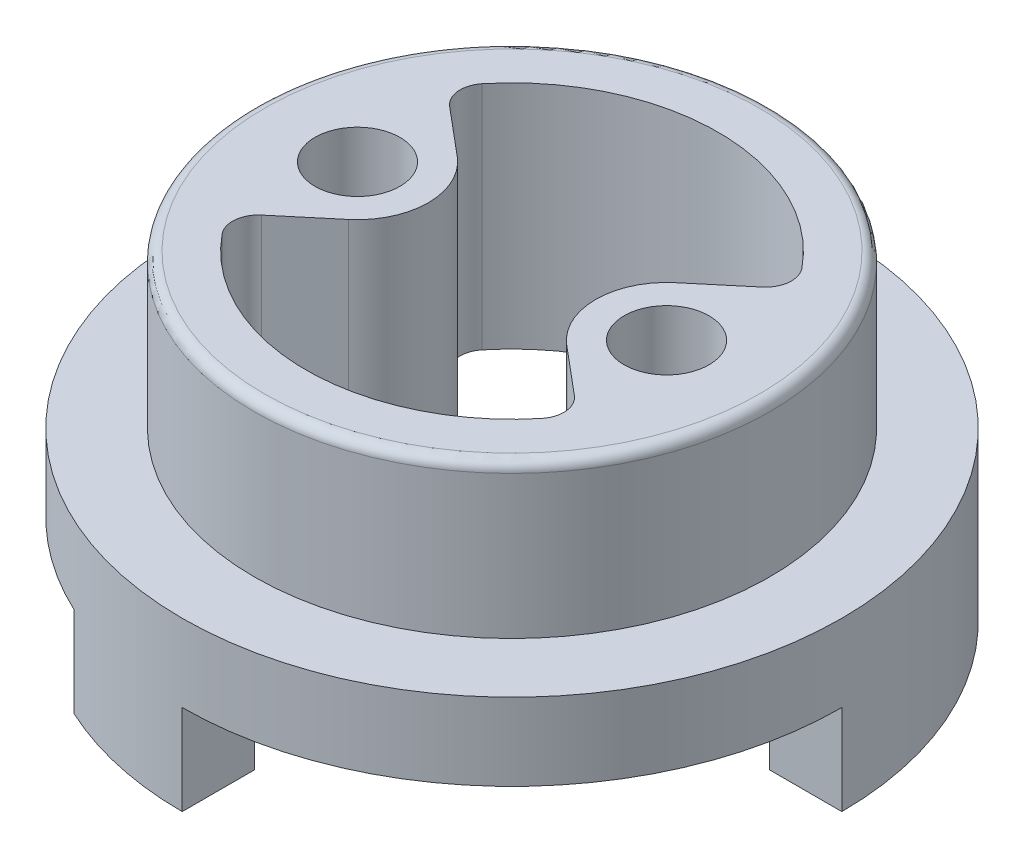
from build123d import *
from build123d.topology import SkipClean

# Parameters (mm, degrees)
SKETCH_1_R             = 12.8
EXTRUDE_1_DEPTH        = 3
SKETCH_2_R             = 10.01
EXTRUDE_2_DEPTH        = 5.95
SKETCH_3_R             = 8
CUT_EXTRUDE_1_DEPTH    = 21.193625232
EXTRUDE_START          = 8.95
SKETCH_4_R             = 1.65
EXTRUDE_3_DEPTH        = 8.95
FILLET_1_R             = 1
FILLET_1_OF_MIRROR_1_R = 1
FILLET_2_R             = 0.4
EXTRUDE_START_2        = 3.5
EXTRUDE_4_DEPTH        = 3.5
FILLET_3_R             = 1


with BuildPart() as part:
    # 草图1 → 凸台-拉伸1 (new body)
    with BuildSketch(Plane(origin=(0, 0, 0), x_dir=(1, 0, 0), z_dir=(0, 1, 0))):
        with Locations(Location((0, 0, 0), (0, 0, 270))):
            Circle(SKETCH_1_R)
    extrude(amount=EXTRUDE_1_DEPTH)

    # 草图2 → 凸台-拉伸2 (add)
    with BuildSketch(Plane(origin=(0, 3, 0), x_dir=(1, 0, 0), z_dir=(0, 1, 0))):
        with Locations(Location((0, 0, 0), (0, 0, 270))):
            Circle(SKETCH_2_R)
    extrude(amount=EXTRUDE_2_DEPTH)

    # 草图3 → 切除-拉伸1 (cut, through all)
    with BuildSketch(Plane(origin=(0, 8.95, 0), x_dir=(1, 0, 0), z_dir=(0, 1, 0))):
        with Locations(Location((0, 0, 0), (0, 0, 270))):
            Circle(SKETCH_3_R)
    extrude(amount=-CUT_EXTRUDE_1_DEPTH, mode=Mode.SUBTRACT)

    # 草图4 → 凸台-拉伸3 (add)
    with BuildSketch(Plane(origin=(0, 0, 0), x_dir=(1, 0, 0), z_dir=(0, 1, 0)).offset(EXTRUDE_START)):
        with BuildLine():
            Line((-6.780819092, 4.245055058), (-4.232334073, 2.106622219))
            ThreePointArc((-4.232334073, 2.106622219), (-3.25, 0), (-4.232334073, -2.106622219))
            Line((-4.232334073, -2.106622219), (-6.780819092, -4.245055058))
            ThreePointArc((-6.780819092, -4.245055058), (-8, 0), (-6.780819092, 4.245055058))
        make_face()
        with Locations(Location((-6, 0, 0), (0, 0, 270))):
            Circle(SKETCH_4_R, mode=Mode.SUBTRACT)
    extrude_3 = extrude(amount=-EXTRUDE_3_DEPTH)

    # 圆角1
    fillet_1_edges = [part.edges().sort_by_distance(p)[0] for p in [
        (-6.780819092, 4.475, 4.245055058),
        (-6.780819092, 4.475, -4.245055058),
    ]]
    fillet(fillet_1_edges, radius=FILLET_1_R)

    # 镜向1: 凸台-拉伸3 across plane
    add(extrude_3.mirror(Plane(origin=(0, 0, 0), x_dir=(0, 0, 1), z_dir=(1, 0, 0))))

    # 圆角1 of 镜向1
    fillet_1_of_mirror_1_edges = [part.edges().sort_by_distance(p)[0] for p in [
        (6.780819092, 4.475, 4.245055058),
        (6.780819092, 4.475, -4.245055058),
    ]]
    fillet(fillet_1_of_mirror_1_edges, radius=FILLET_1_OF_MIRROR_1_R)

    # 圆角2
    fillet_2_edges = [part.edges().sort_by_distance(p)[0] for p in [
        (0, 8.95, -10.01),
    ]]
    fillet(fillet_2_edges, radius=FILLET_2_R)

    # 草图5 → 凸台-拉伸4 (add)
    with SkipClean():  # the faces are left unmerged after this step: merging them gives an invalid solid
        with BuildSketch(Plane.XZ.offset(EXTRUDE_START_2)):
            with BuildLine():
                ThreePointArc((0.005, -12.799999023), (9.050966799, -9.050966799), (12.799999023, -0.005))
                Line((12.799999023, -0.005), (9.99999875, -0.005))
                ThreePointArc((9.99999875, -0.005), (7.071067812, -7.071067812), (0.005, -9.99999875))
                Line((0.005, -9.99999875), (0.005, -12.799999023))
            make_face()
            with BuildLine():
                Line((-9.06307787, 4.226182617), (-11.600739674, 5.40951375))
                ThreePointArc((-11.600739674, 5.40951375), (-12.496047554, 2.772867746), (-12.799999023, 0.005))
                Line((-12.799999023, 0.005), (-9.99999875, 0.005))
                ThreePointArc((-9.99999875, 0.005), (-9.762418667, 2.166836812), (-9.06307787, 4.226182617))
            make_face()
            with BuildLine():
                Line((-0.005, 9.99999875), (-0.005, 12.799999023))
                ThreePointArc((-0.005, 12.799999023), (-2.772867746, 12.496047554), (-5.40951375, 11.600739674))
                Line((-5.40951375, 11.600739674), (-4.226182617, 9.06307787))
                ThreePointArc((-4.226182617, 9.06307787), (-2.166836812, 9.762418667), (-0.005, 9.99999875))
            make_face()
        extrude(amount=-EXTRUDE_4_DEPTH)

    # 圆角3
    fillet_3_edges = [part.edges().sort_by_distance(p)[0] for p in [
        (-2.166836812, 0, 9.762418667),
        (7.071067812, 0, -7.071067812),
        (-9.762418667, 0, 2.166836812),
    ]]
    fillet(fillet_3_edges, radius=FILLET_3_R)


solid = part.part
